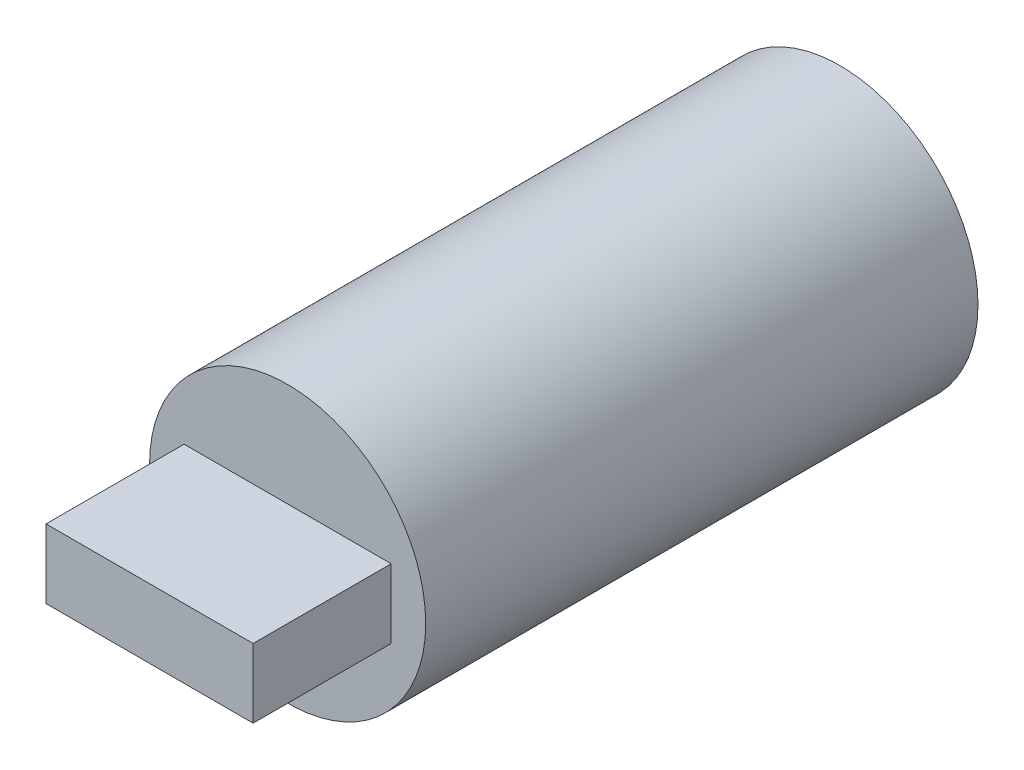
from build123d import *

# Parameters (mm, degrees)
SKETCH_1_R      = 10
EXTRUDE_1_DEPTH = 40
SKETCH_2_W      = 15
SKETCH_2_H      = 5
EXTRUDE_2_DEPTH = 10


with BuildPart() as part:
    # 스케치1 → 보스-돌출1 (new body)
    with BuildSketch(Plane.XY):
        Circle(SKETCH_1_R)
    extrude(amount=EXTRUDE_1_DEPTH)

    # 스케치2 → 보스-돌출2 (add)
    with BuildSketch(Plane.XY.offset(40)):
        Rectangle(SKETCH_2_W, SKETCH_2_H)
    extrude(amount=EXTRUDE_2_DEPTH)


solid = part.part
